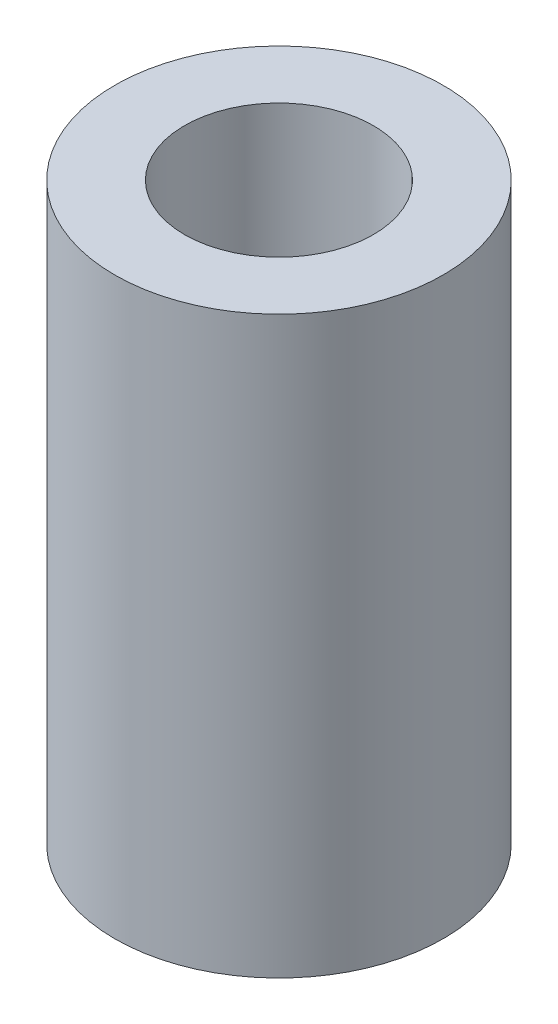
from build123d import *

# Parameters (mm, degrees)
SKETCH1_R           = 2
SKETCH1_R_2         = 1.15
BOSS_EXTRUDE1_DEPTH = 7


with BuildPart() as part:
    # Sketch1 → Boss-Extrude1 (new body)
    with BuildSketch(Plane(origin=(0, 0, 0), x_dir=(1, 0, 0), z_dir=(0, 1, 0))):
        with Locations(Location((0, 0, 0), (0, 0, 270))):
            Circle(SKETCH1_R)
        with Locations(Location((0, 0, 0), (0, 0, 270))):
            Circle(SKETCH1_R_2, mode=Mode.SUBTRACT)
    extrude(amount=BOSS_EXTRUDE1_DEPTH)


solid = part.part
